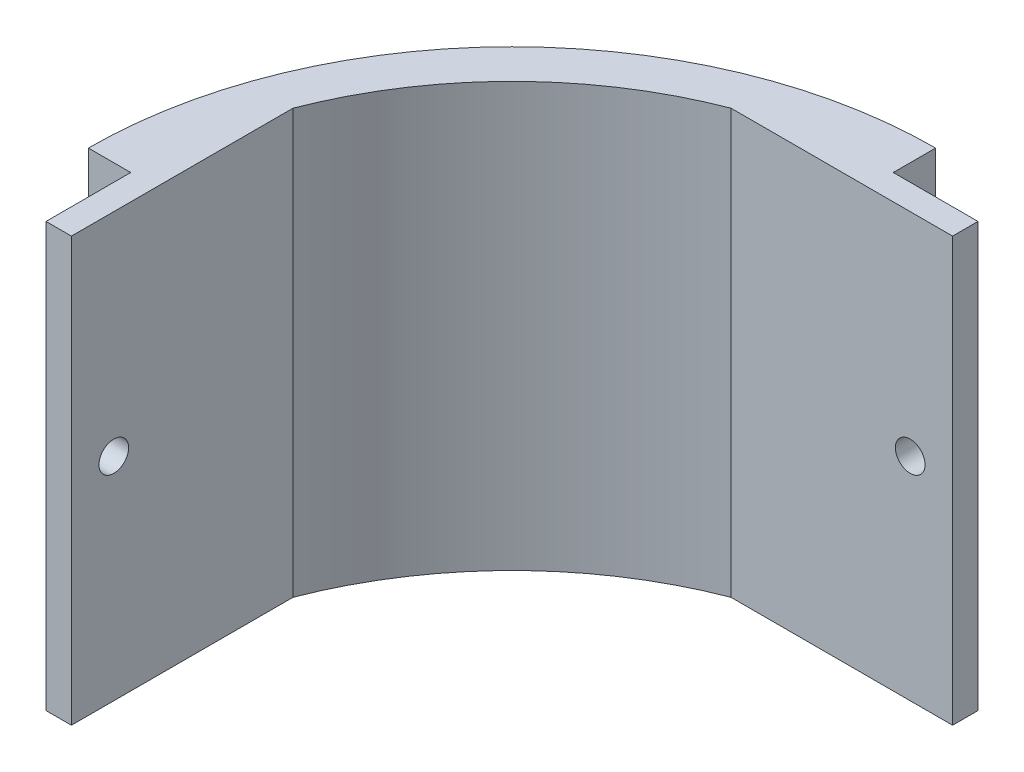
from build123d import *

# Parameters (mm, degrees)
BOSS_EXTRUDE1_DEPTH             = 50
SKETCH2_W                       = 3
SKETCH2_H                       = 50
BOSS_EXTRUDE2_DEPTH             = 10
BOSS_EXTRUDE2_DIRECTION_2_REACH = 88.603
SKETCH4_W                       = 3
SKETCH4_H                       = 50
BOSS_EXTRUDE3_DEPTH             = 10
BOSS_EXTRUDE3_DIRECTION_2_REACH = 88.603
SKETCH5_R                       = 1.75
CUT_EXTRUDE1_DEPTH              = 10
SKETCH6_R                       = 1.75
CUT_EXTRUDE2_DEPTH              = 10


with BuildPart() as part:
    # Sketch1 → Boss-Extrude1 (new body)
    with BuildSketch(Plane(origin=(0, 0, 0), x_dir=(1, 0, 0), z_dir=(0, 1, 0))):
        with BuildLine():
            Line((-50, 0), (-45, 0))
            ThreePointArc((-45, 0), (-31.819805153, 31.819805153), (0, 45))
            Line((0, 45), (0, 50))
            ThreePointArc((0, 50), (-35.355339059, 35.355339059), (-50, 0))
        make_face()
    extrude(amount=BOSS_EXTRUDE1_DEPTH)

    # Sketch2 → Boss-Extrude2 (add)
    with BuildSketch(Plane.XY):
        with Locations((-43.5, 25)):
            Rectangle(SKETCH2_W, SKETCH2_H)
    extrude(amount=BOSS_EXTRUDE2_DEPTH)

    # Sketch2 → Boss-Extrude2 direction 2 (add, up to next)
    with BuildSketch(Plane.XY, mode=Mode.PRIVATE) as boss_extrude2_direction_2_sk1:
        with Locations((-43.5, 25)):
            Rectangle(SKETCH2_W, SKETCH2_H)
    boss_extrude2_direction_2_tool1 = extrude(boss_extrude2_direction_2_sk1.sketch, amount=-BOSS_EXTRUDE2_DIRECTION_2_REACH, mode=Mode.PRIVATE) - part.part
    add(boss_extrude2_direction_2_tool1.solids().sort_by_distance((-43.5, 25, 0))[0])

    # Sketch4 → Boss-Extrude3 (add)
    with BuildSketch(Plane(origin=(0, 0, 0), x_dir=(0, 0, -1), z_dir=(1, 0, 0))):
        with Locations((43.5, 25)):
            Rectangle(SKETCH4_W, SKETCH4_H)
    extrude(amount=BOSS_EXTRUDE3_DEPTH)

    # Sketch4 → Boss-Extrude3 direction 2 (add, up to next)
    with BuildSketch(Plane(origin=(0, 0, 0), x_dir=(0, 0, -1), z_dir=(1, 0, 0)), mode=Mode.PRIVATE) as boss_extrude3_direction_2_sk1:
        with Locations((43.5, 25)):
            Rectangle(SKETCH4_W, SKETCH4_H)
    boss_extrude3_direction_2_tool1 = extrude(boss_extrude3_direction_2_sk1.sketch, amount=-BOSS_EXTRUDE3_DIRECTION_2_REACH, mode=Mode.PRIVATE) - part.part
    add(boss_extrude3_direction_2_tool1.solids().sort_by_distance((0, 25, -43.5))[0])

    # Sketch5 → Cut-Extrude1 (cut)
    with BuildSketch(Plane(origin=(0, 0, -45), x_dir=(-1, 0, 0), z_dir=(0, 0, -1))):
        with Locations((-5, 25)):
            Circle(SKETCH5_R)
    extrude(amount=-CUT_EXTRUDE1_DEPTH, mode=Mode.SUBTRACT)

    # Sketch6 → Cut-Extrude2 (cut)
    with BuildSketch(Plane.ZY.offset(45)):
        with Locations((5, 25)):
            Circle(SKETCH6_R)
    extrude(amount=-CUT_EXTRUDE2_DEPTH, mode=Mode.SUBTRACT)


solid = part.part
